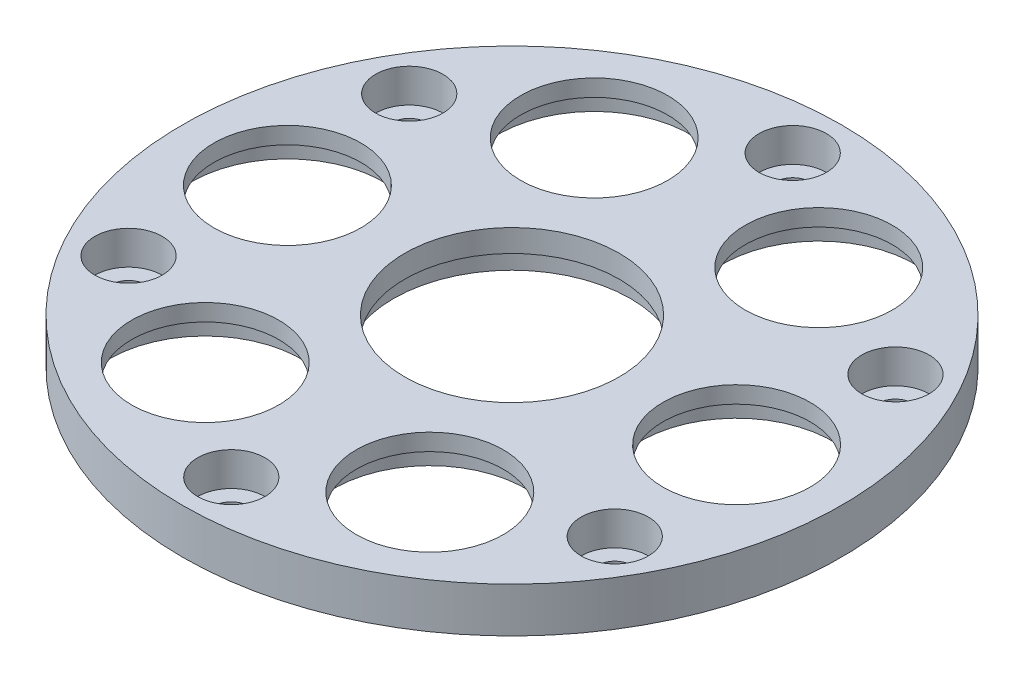
from build123d import *

# Parameters (mm, degrees)
SKETCH1_R           = 29.35
BOSS_EXTRUDE1_DEPTH = 4
SKETCH1_4_R         = 9.55
SKETCH1_4_R_2       = 6.55
SKETCH1_4_R_3       = 1.55
CUT_EXTRUDE1_DEPTH  = 42.699460428
CUT_EXTRUDE2_START  = -1.5
SKETCH1_5_R         = 8.55
SKETCH1_5_R_2       = 6.55
CUT_EXTRUDE2_DEPTH  = 41.199460428
CUT_EXTRUDE3_START  = -2
SKETCH1_6_R         = 10.55
SKETCH1_6_R_2       = 9.55
CUT_EXTRUDE3_DEPTH  = 40.699460428
SKETCH1_7_R         = 3
SKETCH1_7_R_2       = 1.55
CUT_EXTRUDE4_DEPTH  = 3


with BuildPart() as part:
    # Sketch1 → Boss-Extrude1 (new body)
    with BuildSketch(Plane(origin=(0, 0, 0), x_dir=(1, 0, 0), z_dir=(0, 1, 0))):
        Circle(SKETCH1_R)
    extrude(amount=-BOSS_EXTRUDE1_DEPTH)

    # Sketch1<4> → Cut-Extrude1 (cut, through all)
    with BuildSketch(Plane(origin=(0, 0, 0), x_dir=(1, 0, 0), z_dir=(0, 1, 0))):
        Circle(SKETCH1_4_R)
        with Locations((-20, 0)):
            Circle(SKETCH1_4_R_2)
        with Locations((-10, 17.320508076)):
            Circle(SKETCH1_4_R_2)
        with Locations((10, 17.320508076)):
            Circle(SKETCH1_4_R_2)
        with Locations((20, 0)):
            Circle(SKETCH1_4_R_2)
        with Locations((10, -17.320508076)):
            Circle(SKETCH1_4_R_2)
        with Locations((-10, -17.320508076)):
            Circle(SKETCH1_4_R_2)
        with Locations((0, 25)):
            Circle(SKETCH1_4_R_3)
        with Locations((21.650635095, 12.5)):
            Circle(SKETCH1_4_R_3)
        with Locations((21.650635095, -12.5)):
            Circle(SKETCH1_4_R_3)
        with Locations((0, -25)):
            Circle(SKETCH1_4_R_3)
        with Locations((-21.650635095, -12.5)):
            Circle(SKETCH1_4_R_3)
        with Locations((-21.650635095, 12.5)):
            Circle(SKETCH1_4_R_3)
    extrude(amount=-CUT_EXTRUDE1_DEPTH, mode=Mode.SUBTRACT)

    # Sketch1<5> → Cut-Extrude2 (cut, through all)
    # profile 1 of 6: a face of its own
    with BuildSketch(Plane(origin=(0, 0, 0), x_dir=(1, 0, 0), z_dir=(0, 1, 0)).offset(CUT_EXTRUDE2_START)):
        with Locations((-20, 0)):
            Circle(SKETCH1_5_R)
        with Locations((-20, 0)):
            Circle(SKETCH1_5_R_2, mode=Mode.SUBTRACT)
    # profile 2 of 6: a face of its own
    with BuildSketch(Plane(origin=(0, 0, 0), x_dir=(1, 0, 0), z_dir=(0, 1, 0)).offset(CUT_EXTRUDE2_START)):
        with Locations((-10, 17.320508076)):
            Circle(SKETCH1_5_R)
        with Locations((-10, 17.320508076)):
            Circle(SKETCH1_5_R_2, mode=Mode.SUBTRACT)
    # profile 3 of 6: a face of its own
    with BuildSketch(Plane(origin=(0, 0, 0), x_dir=(1, 0, 0), z_dir=(0, 1, 0)).offset(CUT_EXTRUDE2_START)):
        with Locations((10, 17.320508076)):
            Circle(SKETCH1_5_R)
        with Locations((10, 17.320508076)):
            Circle(SKETCH1_5_R_2, mode=Mode.SUBTRACT)
    # profile 4 of 6: a face of its own
    with BuildSketch(Plane(origin=(0, 0, 0), x_dir=(1, 0, 0), z_dir=(0, 1, 0)).offset(CUT_EXTRUDE2_START)):
        with Locations((20, 0)):
            Circle(SKETCH1_5_R)
        with Locations((20, 0)):
            Circle(SKETCH1_5_R_2, mode=Mode.SUBTRACT)
    # profile 5 of 6: a face of its own
    with BuildSketch(Plane(origin=(0, 0, 0), x_dir=(1, 0, 0), z_dir=(0, 1, 0)).offset(CUT_EXTRUDE2_START)):
        with Locations((10, -17.320508076)):
            Circle(SKETCH1_5_R)
        with Locations((10, -17.320508076)):
            Circle(SKETCH1_5_R_2, mode=Mode.SUBTRACT)
    # profile 6 of 6: a face of its own
    with BuildSketch(Plane(origin=(0, 0, 0), x_dir=(1, 0, 0), z_dir=(0, 1, 0)).offset(CUT_EXTRUDE2_START)):
        with Locations((-10, -17.320508076)):
            Circle(SKETCH1_5_R)
        with Locations((-10, -17.320508076)):
            Circle(SKETCH1_5_R_2, mode=Mode.SUBTRACT)
    extrude(amount=-CUT_EXTRUDE2_DEPTH, mode=Mode.SUBTRACT)

    # Sketch1<6> → Cut-Extrude3 (cut, through all)
    with BuildSketch(Plane(origin=(0, 0, 0), x_dir=(1, 0, 0), z_dir=(0, 1, 0)).offset(CUT_EXTRUDE3_START)):
        Circle(SKETCH1_6_R)
        Circle(SKETCH1_6_R_2, mode=Mode.SUBTRACT)
    extrude(amount=-CUT_EXTRUDE3_DEPTH, mode=Mode.SUBTRACT)

    # Sketch1<7> → Cut-Extrude4 (cut)
    # profile 1 of 6: a face of its own
    with BuildSketch(Plane(origin=(0, 0, 0), x_dir=(1, 0, 0), z_dir=(0, 1, 0))):
        with Locations((0, 25)):
            Circle(SKETCH1_7_R)
        with Locations((0, 25)):
            Circle(SKETCH1_7_R_2, mode=Mode.SUBTRACT)
    # profile 2 of 6: a face of its own
    with BuildSketch(Plane(origin=(0, 0, 0), x_dir=(1, 0, 0), z_dir=(0, 1, 0))):
        with Locations((21.650635095, 12.5)):
            Circle(SKETCH1_7_R)
        with Locations((21.650635095, 12.5)):
            Circle(SKETCH1_7_R_2, mode=Mode.SUBTRACT)
    # profile 3 of 6: a face of its own
    with BuildSketch(Plane(origin=(0, 0, 0), x_dir=(1, 0, 0), z_dir=(0, 1, 0))):
        with Locations((21.650635095, -12.5)):
            Circle(SKETCH1_7_R)
        with Locations((21.650635095, -12.5)):
            Circle(SKETCH1_7_R_2, mode=Mode.SUBTRACT)
    # profile 4 of 6: a face of its own
    with BuildSketch(Plane(origin=(0, 0, 0), x_dir=(1, 0, 0), z_dir=(0, 1, 0))):
        with Locations((0, -25)):
            Circle(SKETCH1_7_R)
        with Locations((0, -25)):
            Circle(SKETCH1_7_R_2, mode=Mode.SUBTRACT)
    # profile 5 of 6: a face of its own
    with BuildSketch(Plane(origin=(0, 0, 0), x_dir=(1, 0, 0), z_dir=(0, 1, 0))):
        with Locations((-21.650635095, -12.5)):
            Circle(SKETCH1_7_R)
        with Locations((-21.650635095, -12.5)):
            Circle(SKETCH1_7_R_2, mode=Mode.SUBTRACT)
    # profile 6 of 6: a face of its own
    with BuildSketch(Plane(origin=(0, 0, 0), x_dir=(1, 0, 0), z_dir=(0, 1, 0))):
        with Locations((-21.650635095, 12.5)):
            Circle(SKETCH1_7_R)
        with Locations((-21.650635095, 12.5)):
            Circle(SKETCH1_7_R_2, mode=Mode.SUBTRACT)
    extrude(amount=-CUT_EXTRUDE4_DEPTH, mode=Mode.SUBTRACT)


solid = part.part
